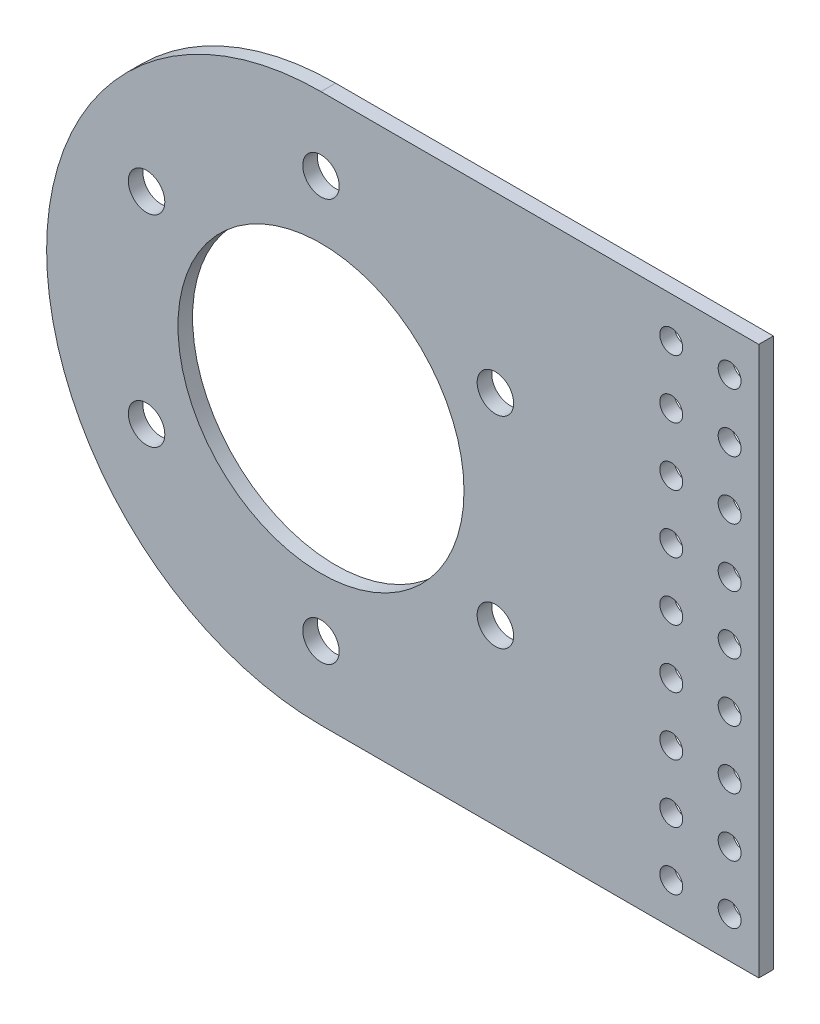
from build123d import *

# Parameters (mm, degrees)
SKETCH1_R                      = 31.115
BOSS_EXTRUDE1_DEPTH            = 3.175
F_9_0_196_DIAMETER_HOLE1_D     = 4.9784
F_5_16_0_3125_DIAMETER_HOLE1_D = 7.9375


with BuildPart() as part:
    # Sketch1 → Boss-Extrude1 (new body)
    with BuildSketch(Plane(origin=(0, 0, 0), x_dir=(0, 1, 0), z_dir=(0, 0, 1))):
        with BuildLine():
            Line((-59.69, 0), (-59.69, -95.25))
            Line((-59.69, -95.25), (59.69, -95.25))
            Line((59.69, -95.25), (59.69, 0))
            ThreePointArc((59.69, 0), (0, 59.69), (-59.69, 0))
        make_face()
        with Locations(Location((0, 0, 0), (0, 0, 270))):
            Circle(SKETCH1_R, mode=Mode.SUBTRACT)
    extrude(amount=BOSS_EXTRUDE1_DEPTH)

    # #9 (0.196) Diameter Hole1 (through all)
    with Locations(Plane.XY.offset(3.175)):
        with Locations((88.9, -50.8), (76.2, -50.8), (76.2, -38.1), (76.2, -25.4), (76.2, -12.7), (76.2, 0), (76.2, 12.7), (76.2, 25.4), (76.2, 38.1), (76.2, 50.8), (88.9, -38.1), (88.9, -25.4), (88.9, -12.7), (88.9, 0), (88.9, 12.7), (88.9, 25.4), (88.9, 38.1), (88.9, 50.8)):
            Hole(F_9_0_196_DIAMETER_HOLE1_D / 2)

    # 5/16 (0.3125) Diameter Hole1 (through all)
    with Locations(Plane.XY.offset(3.175)):
        with Locations((37.944903067, 21.9075), (37.944903067, -21.9075), (0, -43.815), (-37.944903067, -21.9075), (-37.944903067, 21.9075), (0, 43.815)):
            Hole(F_5_16_0_3125_DIAMETER_HOLE1_D / 2)


solid = part.part
